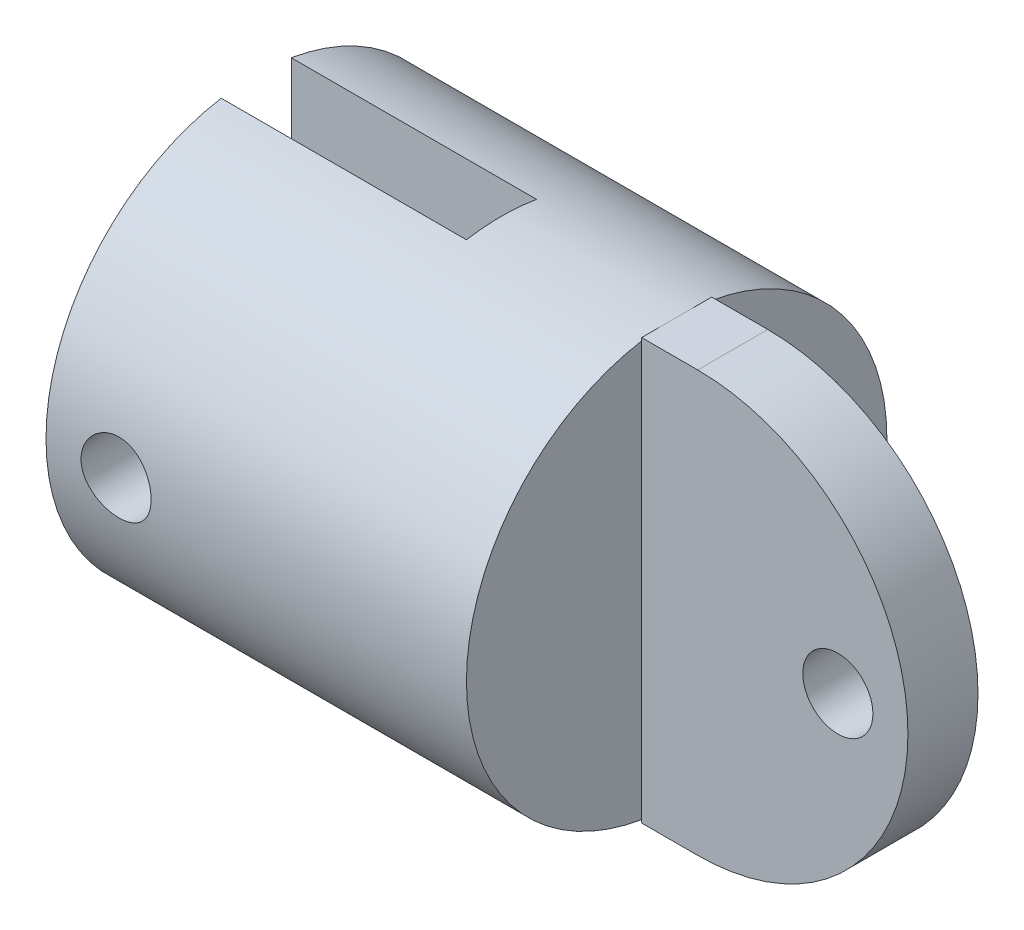
from build123d import *

# Parameters (mm, degrees)
SKETCH2_R               = 15
BOSS_EXTRUDE1_DEPTH     = 30
CUT_EXTRUDE1_DEPTH      = 37.742346142
CUT_EXTRUDE1_DEPTH_BACK = 37.742346142
SKETCH3_W               = 17.5
SKETCH3_H               = 5
CUT_EXTRUDE2_DEPTH      = 37.742346142
CUT_EXTRUDE2_DEPTH_BACK = 37.742346142
SKETCH6_R               = 2.5
SKETCH7_W               = 5
SKETCH7_H               = 30
BOSS_EXTRUDE2_DEPTH     = 4
BOSS_EXTRUDE3_DEPTH     = 5
CUT_EXTRUDE3_DEPTH      = 38.831865041
CUT_EXTRUDE3_DEPTH_BACK = 38.831865041
SKETCH9_R               = 2.5


with BuildPart() as part:
    # Sketch2 → Boss-Extrude1 (new body)
    with BuildSketch(Plane(origin=(0, 0, 0), x_dir=(0, 0, -1), z_dir=(1, 0, 0))):
        Circle(SKETCH2_R)
    extrude(amount=-BOSS_EXTRUDE1_DEPTH)

    # Sketch3 → Cut-Extrude1 (cut, two sides: drawn at the far end of the back side and taken through both)
    with BuildSketch(Plane(origin=(0, 0, 0), x_dir=(1, 0, 0), z_dir=(0, 1, 0)).offset(-CUT_EXTRUDE1_DEPTH_BACK)):
        with Locations((-21.25, 0)):
            Rectangle(SKETCH3_W, SKETCH3_H)
    extrude(amount=CUT_EXTRUDE1_DEPTH + CUT_EXTRUDE1_DEPTH_BACK, mode=Mode.SUBTRACT)

    # Sketch6 → Cut-Extrude2 (cut, two sides: drawn at the far end of the back side and taken through both)
    with BuildSketch(Plane.XY.offset(-CUT_EXTRUDE2_DEPTH_BACK)):
        with Locations((-25, 0)):
            Circle(SKETCH6_R)
    extrude(amount=CUT_EXTRUDE2_DEPTH + CUT_EXTRUDE2_DEPTH_BACK, mode=Mode.SUBTRACT)

    # Sketch7 → Boss-Extrude2 (add)
    with BuildSketch(Plane(origin=(0, 0, 0), x_dir=(0, 0, -1), z_dir=(1, 0, 0))):
        Rectangle(SKETCH7_W, SKETCH7_H)
    extrude(amount=BOSS_EXTRUDE2_DEPTH)

    # Sketch8 → Boss-Extrude3 (add)
    with BuildSketch(Plane.XY.offset(2.5)):
        with BuildLine():
            Line((4, 15), (4, -15))
            ThreePointArc((4, -15), (19, 0), (4, 15))
        make_face()
    extrude(amount=-BOSS_EXTRUDE3_DEPTH)

    # Sketch9 → Cut-Extrude3 (cut, two sides: drawn at the far end of the back side and taken through both)
    with BuildSketch(Plane.XY.offset(2.5).offset(-CUT_EXTRUDE3_DEPTH_BACK)):
        with Locations(Location((14, 0, 0), (0, 0, 270))):
            Circle(SKETCH9_R)
    extrude(amount=CUT_EXTRUDE3_DEPTH + CUT_EXTRUDE3_DEPTH_BACK, mode=Mode.SUBTRACT)


solid = part.part
